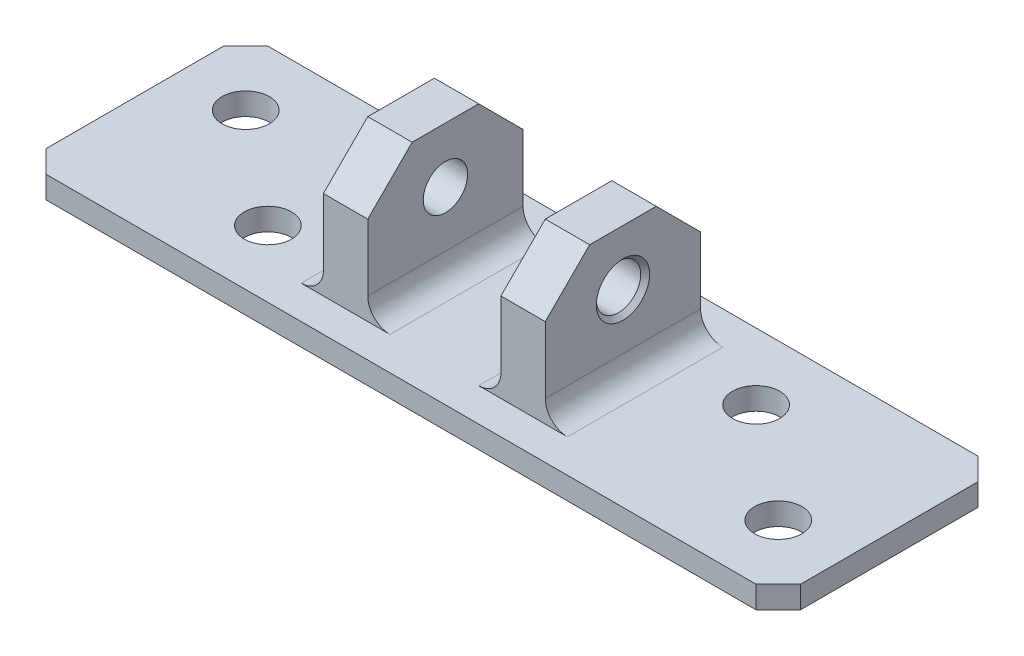
from build123d import *

# Parameters (mm, degrees)
SKETCH1_W               = 107.95
SKETCH1_H               = 31.75
BOSS_EXTRUDE1_DEPTH     = 1.5875
F_1_4_CLEARANCE_HOLE1_D = 6.7564
SKETCH4_W               = 6.35
SKETCH4_H               = 22.225
BOSS_EXTRUDE2_DEPTH     = 19.05
CHAMFER2_SIZE           = 3.175
FILLET1_R               = 3.175
CHAMFER3_SIZE           = 6.35


with BuildPart() as part:
    # Sketch1 → Boss-Extrude1 (new, symmetric)
    with BuildSketch(Plane(origin=(0, 0, 0), x_dir=(1, 0, 0), z_dir=(0, 1, 0))):
        Rectangle(SKETCH1_W, SKETCH1_H)
    extrude(amount=BOSS_EXTRUDE1_DEPTH, both=True)

    # 1/4 Clearance Hole1 (through all)
    with Locations(Plane(origin=(0, 1.5875, 0), x_dir=(1, 0, 0), z_dir=(0, 1, 0))):
        with Locations((-44.45, 6.35), (28.575, 6.35), (-28.575, -6.35), (44.45, -6.35)):
            Hole(F_1_4_CLEARANCE_HOLE1_D / 2)

    # Sketch4 → Boss-Extrude2 (add)
    with BuildSketch(Plane(origin=(0, 1.5875, 0), x_dir=(1, 0, 0), z_dir=(0, 1, 0))):
        with Locations((-12.7, 0)):
            Rectangle(SKETCH4_W, SKETCH4_H)
        with Locations((12.7, 0)):
            Rectangle(SKETCH4_W, SKETCH4_H)
    extrude(amount=BOSS_EXTRUDE2_DEPTH)

    # Chamfer2
    chamfer2_edges = [part.edges().sort_by_distance(p)[0] for p in [
        (-53.975, 0, -15.875),
        (53.975, 0, -15.875),
        (53.975, 0, 15.875),
        (-53.975, 0, 15.875),
    ]]
    chamfer(chamfer2_edges, length=CHAMFER2_SIZE)

    # Fillet1
    fillet1_edges = [part.edges().sort_by_distance(p)[0] for p in [
        (-15.875, 1.5875, 0),
        (-9.525, 1.5875, 0),
        (9.525, 1.5875, 0),
        (15.875, 1.5875, 0),
    ]]
    fillet(fillet1_edges, radius=FILLET1_R)

    # Sketch6 → 1/4 (0.25) Diameter Hole1 (revolve, cut)
    with BuildSketch(Plane(origin=(15.875, 12.7, 0), x_dir=(0, 0, -1), z_dir=(0, 1, 0))):
        Polygon((0, 0), (0, 31.75), (3.81, 31.75), (3.175, 31.115), (3.175, 0.635), (3.81, 0), align=None)
    revolve(axis=Axis((22.225, 12.7, 0), (-1, 0, 0)), mode=Mode.SUBTRACT)

    # Chamfer3
    chamfer3_edges = [part.edges().sort_by_distance(p)[0] for p in [
        (-12.7, 20.6375, 11.1125),
        (-12.7, 20.6375, -11.1125),
        (12.7, 20.6375, 11.1125),
        (12.7, 20.6375, -11.1125),
    ]]
    chamfer(chamfer3_edges, length=CHAMFER3_SIZE)


solid = part.part
